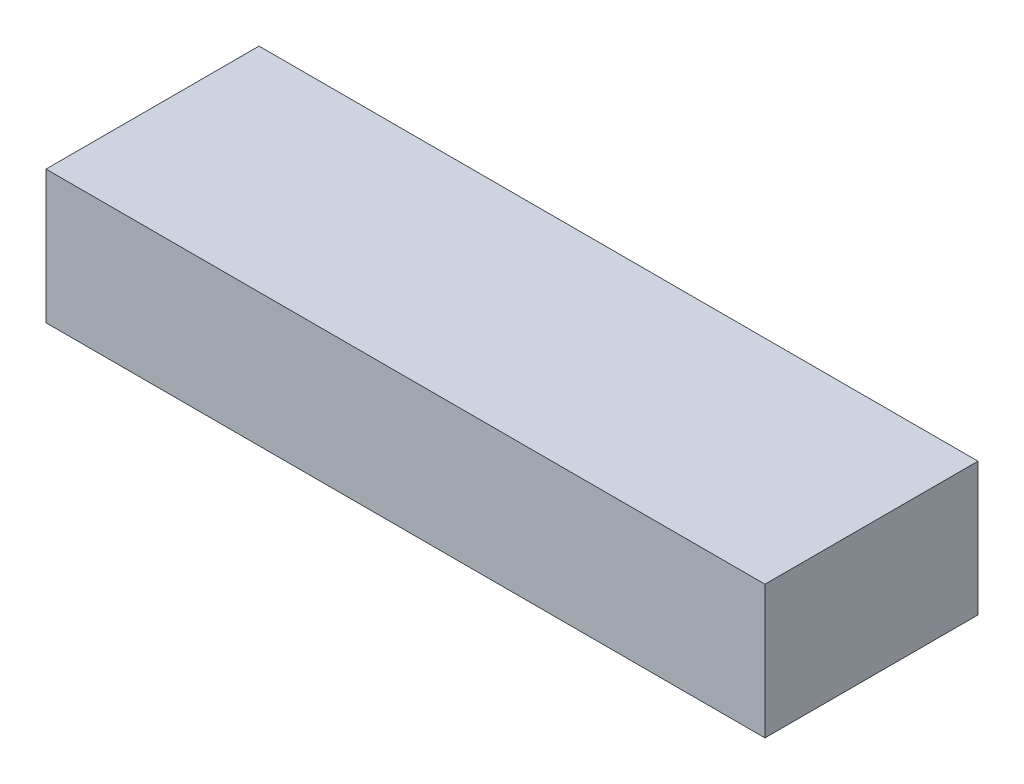
from build123d import *

# Parameters (mm, degrees)
SKETCH1_W           = 135
SKETCH1_H           = 40
BOSS_EXTRUDE1_DEPTH = 25


with BuildPart() as part:
    # Sketch1 → Boss-Extrude1 (new body)
    with BuildSketch(Plane(origin=(0, 0, 0), x_dir=(1, 0, 0), z_dir=(0, 1, 0))):
        with Locations((19.651898734, 17.936708861)):
            Rectangle(SKETCH1_W, SKETCH1_H)
    extrude(amount=BOSS_EXTRUDE1_DEPTH)


solid = part.part
